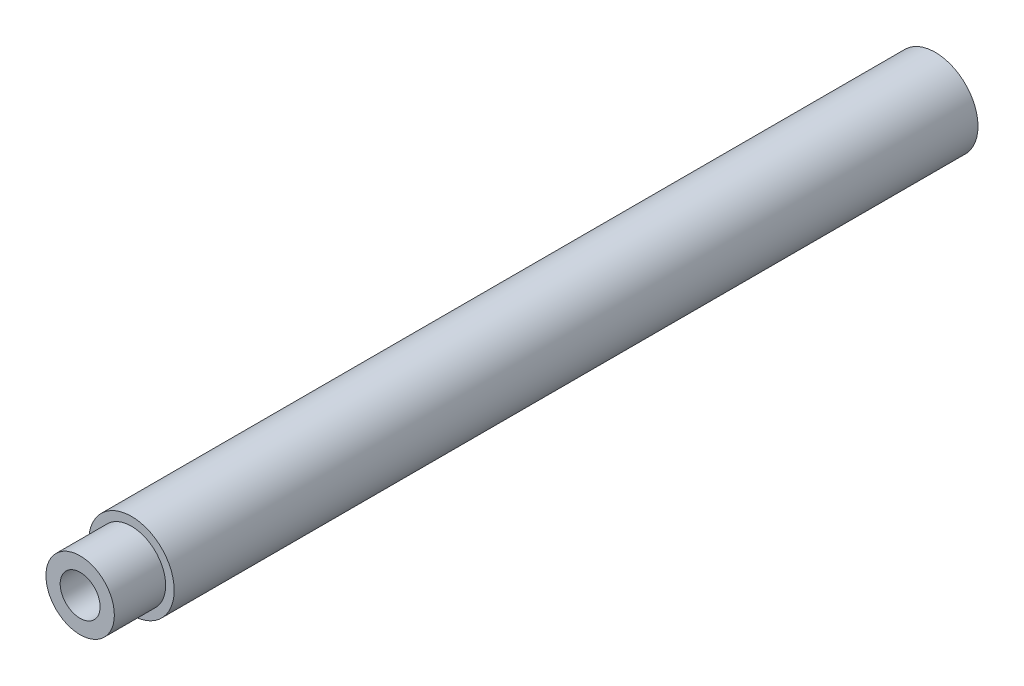
from build123d import *

# Parameters (mm, degrees)
SKETCH1_R           = 7.5
BOSS_EXTRUDE1_DEPTH = 150
CUT_EXTRUDE1_START  = -9
SKETCH2_R           = 7.5
SKETCH2_R_2         = 6
CUT_EXTRUDE1_DEPTH  = 9
SKETCH3_R           = 3.5
CUT_EXTRUDE2_DEPTH  = 20


with BuildPart() as part:
    # Sketch1 → Boss-Extrude1 (new body)
    with BuildSketch(Plane.XY):
        Circle(SKETCH1_R)
    extrude(amount=BOSS_EXTRUDE1_DEPTH)

    # Sketch2 → Cut-Extrude1 (cut)
    with BuildSketch(Plane.XY.offset(150).offset(CUT_EXTRUDE1_START)):
        Circle(SKETCH2_R)
        Circle(SKETCH2_R_2, mode=Mode.SUBTRACT)
    extrude(amount=CUT_EXTRUDE1_DEPTH, mode=Mode.SUBTRACT)

    # Sketch3 → Cut-Extrude2 (cut)
    with BuildSketch(Plane.XY.offset(150)):
        Circle(SKETCH3_R)
    extrude(amount=-CUT_EXTRUDE2_DEPTH, mode=Mode.SUBTRACT)


solid = part.part
